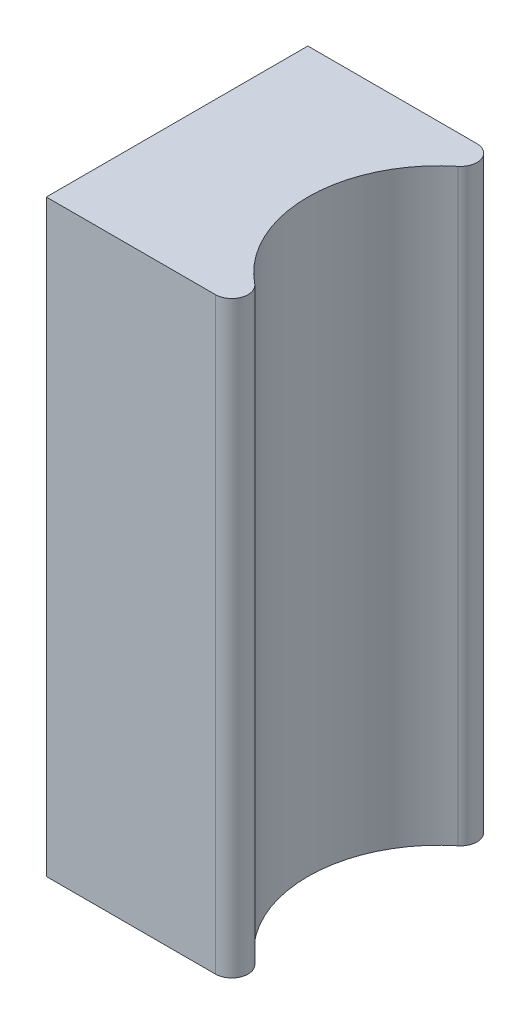
from build123d import *

# Parameters (mm, degrees)
BOSS_EXTRUDE1_DEPTH = 57.15


with BuildPart() as part:
    # Sketch3 → Boss-Extrude1 (new body)
    with BuildSketch(Plane(origin=(0, 0, 0), x_dir=(1, 0, 0), z_dir=(0, 1, 0))):
        with BuildLine():
            Line((-27.78125, 0), (-27.78125, 25.4))
            Line((-27.78125, 25.4), (-11.361506121, 25.4))
            ThreePointArc((-11.361506121, 25.4), (-9.864796768, 24.341666667), (-10.363699885, 22.577777778))
            ThreePointArc((-10.363699885, 22.577777778), (-15.08125, 12.7), (-10.363699885, 2.822222222))
            ThreePointArc((-10.363699885, 2.822222222), (-9.864796768, 1.058333333), (-11.361506121, 0))
            Line((-11.361506121, 0), (-27.78125, 0))
        make_face()
    extrude(amount=BOSS_EXTRUDE1_DEPTH)


solid = part.part
